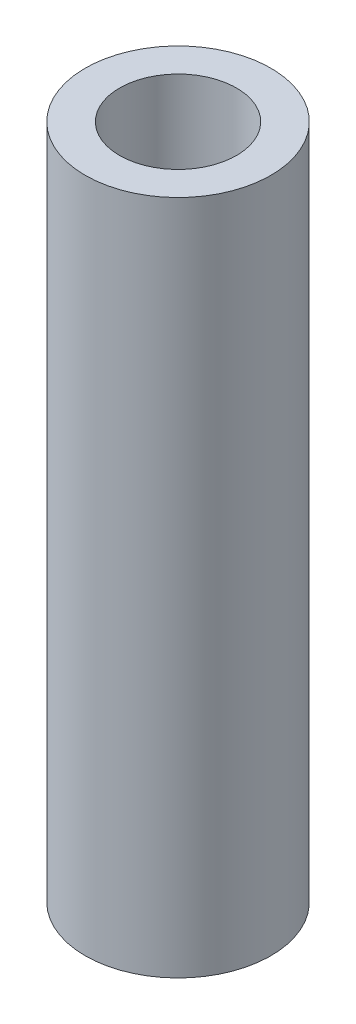
from build123d import *

# Parameters (mm, degrees)
SKETCH1_R           = 3.175
SKETCH1_R_2         = 2
BOSS_EXTRUDE1_DEPTH = 23.114


with BuildPart() as part:
    # Sketch1 → Boss-Extrude1 (new body)
    with BuildSketch(Plane(origin=(0, 0, 0), x_dir=(1, 0, 0), z_dir=(0, 1, 0))):
        with Locations(Location((0, 0, 0), (0, 0, 270))):
            Circle(SKETCH1_R)
        with Locations(Location((0, 0, 0), (0, 0, 270))):
            Circle(SKETCH1_R_2, mode=Mode.SUBTRACT)
    extrude(amount=-BOSS_EXTRUDE1_DEPTH)


solid = part.part
